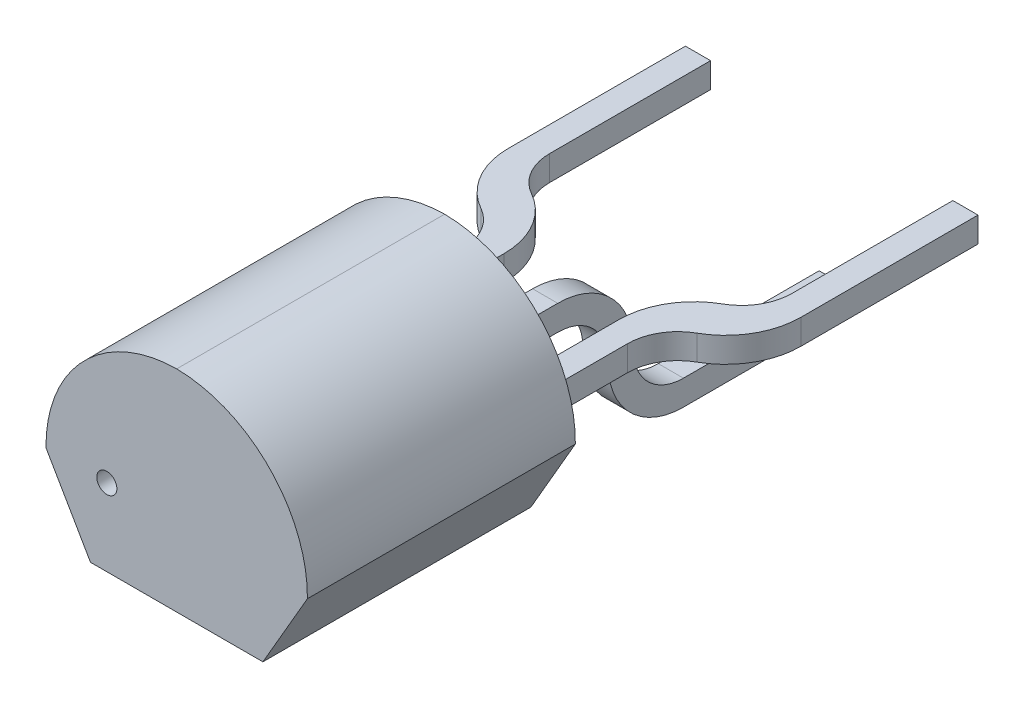
from build123d import *

# Parameters (mm, degrees)
EXTRUDE_1_DEPTH     = 5.33
SKETCH_1_W          = 0.5
SKETCH_1_H          = 0.5
EXTRUDE_2_DEPTH     = 2.54
SKETCH_1_2_W        = 0.5
SKETCH_1_2_H        = 0.5
EXTRUDE_3_DEPTH     = 10.16
SKETCH_4_R          = 0.2
CUT_EXTRUDE_1_DEPTH = 0.5
SKETCH_5_W          = 9.7
SKETCH_5_H          = 0.5
EXTRUDE_4_DEPTH     = 1.27
SKETCH_6_W          = 9.7
SKETCH_6_H          = 0.5
EXTRUDE_5_DEPTH     = 1.27
SKETCH_7_W          = 0.5
SKETCH_7_H          = 9.7
EXTRUDE_6_DEPTH     = 2.54
SKETCH_8_W          = 1.372733762
SKETCH_8_H          = 9.815585296
CUT_EXTRUDE_2_DEPTH = 2.54
SKETCH_9_W          = 9.522444549
SKETCH_9_H          = 3.637804143
CUT_EXTRUDE_3_DEPTH = 1
FILLET_1_R          = 1
FILLET_2_R          = 1.5
SKETCH_10_W         = 0.5
SKETCH_10_H         = 0.5
CUT_EXTRUDE_4_DEPTH = 5
SKETCH_11_R         = 0.1469903
CUT_EXTRUDE_5_DEPTH = 2


with BuildPart() as part:
    # Эскиз3 → Вытянуть1 (new body)
    with BuildSketch(Plane.XY.offset(2.54)):
        with BuildLine():
            Line((-0.325, -1.53), (3.105, -1.53))
            Line((3.105, -1.53), (3.99, 0))
            ThreePointArc((3.99, 0), (3.240904038, 1.868477631), (1.39, 2.66))
            ThreePointArc((1.39, 2.66), (-0.460904038, 1.868477631), (-1.21, 0))
            Line((-1.21, 0), (-0.325, -1.53))
        make_face()
    extrude(amount=EXTRUDE_1_DEPTH)

    # Эскиз1 → Вытянуть2 (add)
    with BuildSketch(Plane.XY):
        with Locations((1.39, 0)):
            Rectangle(SKETCH_1_W, SKETCH_1_H)
        Rectangle(SKETCH_1_W, SKETCH_1_H)
        with Locations((2.78, 0)):
            Rectangle(SKETCH_1_W, SKETCH_1_H)
    extrude(amount=EXTRUDE_2_DEPTH)

    # Эскиз1<2> → Вытянуть3 (add)
    with BuildSketch(Plane.XY):
        with Locations((1.39, 0)):
            Rectangle(SKETCH_1_2_W, SKETCH_1_2_H)
        Rectangle(SKETCH_1_2_W, SKETCH_1_2_H)
        with Locations((2.78, 0)):
            Rectangle(SKETCH_1_2_W, SKETCH_1_2_H)
    extrude(amount=-EXTRUDE_3_DEPTH)

    # Эскиз4 → Вырез-Вытянуть1 (cut)
    with BuildSketch(Plane.XY.offset(7.87)):
        Circle(SKETCH_4_R)
    extrude(amount=-CUT_EXTRUDE_1_DEPTH, mode=Mode.SUBTRACT)

    # Эскиз5 → Вытянуть4 (add)
    with BuildSketch(Plane(origin=(3.03, 0, 0), x_dir=(0, 0, -1), z_dir=(1, 0, 0))):
        with Locations((5.31, 0)):
            Rectangle(SKETCH_5_W, SKETCH_5_H)
    extrude(amount=EXTRUDE_4_DEPTH)

    # Эскиз6 → Вытянуть5 (add)
    with BuildSketch(Plane.ZY.offset(0.25)):
        with Locations((-5.31, 0)):
            Rectangle(SKETCH_6_W, SKETCH_6_H)
    extrude(amount=EXTRUDE_5_DEPTH)

    # Эскиз7 → Вытянуть6 (add)
    with BuildSketch(Plane(origin=(0, -0.25, 0), x_dir=(1, 0, 0), z_dir=(0, 1, 0))):
        with Locations((1.39, 5.31)):
            Rectangle(SKETCH_7_W, SKETCH_7_H)
    extrude(amount=-EXTRUDE_6_DEPTH)

    # Эскиз8 → Вырез-Вытянуть2 (cut)
    with BuildSketch(Plane.XZ.offset(0.25)):
        with Locations((-0.333633119, -5.867792648)):
            Rectangle(SKETCH_8_W, SKETCH_8_H)
        with Locations((3.113633119, -5.867792648)):
            Rectangle(SKETCH_8_W, SKETCH_8_H)
    extrude(amount=-CUT_EXTRUDE_2_DEPTH, mode=Mode.SUBTRACT)

    # Эскиз9 → Вырез-Вытянуть3 (cut)
    with BuildSketch(Plane(origin=(1.64, 0, 0), x_dir=(0, 0, -1), z_dir=(1, 0, 0))):
        with Locations((5.721222275, -0.471097928)):
            Rectangle(SKETCH_9_W, SKETCH_9_H)
    extrude(amount=-CUT_EXTRUDE_3_DEPTH, mode=Mode.SUBTRACT)

    # Скругление1
    fillet_1_edges = [part.edges().sort_by_distance(p)[0] for p in [
        (-1.02, 0, -0.96),
        (1.39, -2.29, -0.96),
        (3.8, 0, -0.96),
        (3.03, 0, -0.46),
        (1.39, -0.25, -0.46),
        (-0.25, 0, -0.46),
    ]]
    fillet(fillet_1_edges, radius=FILLET_1_R)

    # Скругление2
    fillet_2_edges = [part.edges().sort_by_distance(p)[0] for p in [
        (-1.52, 0, -0.46),
        (1.39, -2.79, -0.46),
        (4.3, 0, -0.46),
        (0.25, 0, -0.96),
        (1.39, 0.25, -0.96),
        (2.53, 0, -0.96),
    ]]
    fillet(fillet_2_edges, radius=FILLET_2_R)

    # Эскиз10 → Вырез-Вытянуть4 (cut)
    with BuildSketch(Plane(origin=(0, 0, -10.16), x_dir=(-1, 0, 0), z_dir=(0, 0, -1))):
        with Locations((-1.39, -2.54)):
            Rectangle(SKETCH_10_W, SKETCH_10_H)
        with Locations((1.27, 0)):
            Rectangle(SKETCH_10_W, SKETCH_10_H)
        with Locations((-4.05, 0)):
            Rectangle(SKETCH_10_W, SKETCH_10_H)
    extrude(amount=-CUT_EXTRUDE_4_DEPTH, mode=Mode.SUBTRACT)

    # Эскиз11 → Вырез-Вытянуть5 (cut)
    with BuildSketch(Plane(origin=(0, 0, -5.16), x_dir=(-1, 0, 0), z_dir=(0, 0, -1))):
        with Locations((-1.39, -2.54)):
            Circle(SKETCH_11_R)
    extrude(amount=-CUT_EXTRUDE_5_DEPTH, mode=Mode.SUBTRACT)


solid = part.part
